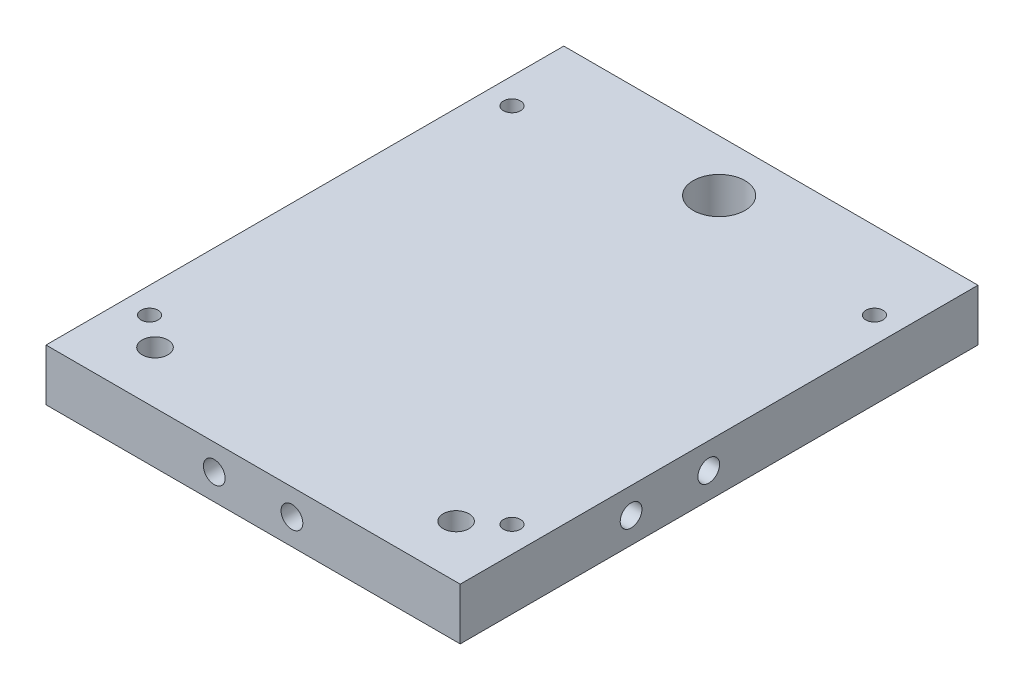
from build123d import *

# Parameters (mm, degrees)
SKETCH_1_W             = 80
SKETCH_1_H             = 100
EXTRUDE_1_DEPTH        = 10
HOLE_WIZARD_1_D        = 10
HOLE_WIZARD_M4_1_D     = 3.3
HOLE_WIZARD_M6_1_D     = 5
HOLE_WIZARD_M5_1_D     = 4.2
HOLE_WIZARD_M5_1_DEPTH = 12.4
HOLE_WIZARD_M5_1_TIP   = 1.2618073
HOLE_WIZARD_M5_2_D     = 4.2
HOLE_WIZARD_M5_2_DEPTH = 12.4
HOLE_WIZARD_M5_2_TIP   = 1.2618073
HOLE_WIZARD_M5_3_D     = 4.2
HOLE_WIZARD_M5_3_DEPTH = 10.4
HOLE_WIZARD_M5_3_TIP   = 1.2618073


with BuildPart() as part:
    # 草图1 → 凸台-拉伸1 (new body)
    with BuildSketch(Plane(origin=(0, 0, 0), x_dir=(1, 0, 0), z_dir=(0, 1, 0))):
        Rectangle(SKETCH_1_W, SKETCH_1_H)
    extrude(amount=EXTRUDE_1_DEPTH)

    # 孔1 (through all)
    with Locations(Plane(origin=(0, 10, 0), x_dir=(1, 0, 0), z_dir=(0, 1, 0))):
        with Locations((0, 40)):
            Hole(HOLE_WIZARD_1_D / 2)

    # M4 螺纹孔1 (through all)
    with Locations(Plane(origin=(0, 0, 0), x_dir=(-1, 0, 0), z_dir=(0, -1, 0))):
        with Locations((35, -35), (-35, -35), (-35, 35), (35, 35)):
            Hole(HOLE_WIZARD_M4_1_D / 2)

    # M6 螺纹孔1 (through all)
    with Locations(Plane(origin=(0, 10, 0), x_dir=(1, 0, 0), z_dir=(0, 1, 0))):
        with Locations((-29.071712183, -39.873872767), (29.071712183, -39.873872767)):
            Hole(HOLE_WIZARD_M6_1_D / 2)

    # M5 螺纹孔1
    with Locations(Plane(origin=(40, 0, 0), x_dir=(0, 0, -1), z_dir=(1, 0, 0))):
        with Locations((-17, 5), (-2, 5)):
            Hole(HOLE_WIZARD_M5_1_D / 2, depth=HOLE_WIZARD_M5_1_DEPTH)
            with Locations((0, 0, -(HOLE_WIZARD_M5_1_DEPTH + HOLE_WIZARD_M5_1_TIP / 2))):  # 118° drill point
                Cone(0, HOLE_WIZARD_M5_1_D / 2, HOLE_WIZARD_M5_1_TIP, mode=Mode.SUBTRACT)

    # M5 螺纹孔2
    with Locations(Plane.ZY.offset(40)):
        with Locations((5, 5), (-8, 5)):
            Hole(HOLE_WIZARD_M5_2_D / 2, depth=HOLE_WIZARD_M5_2_DEPTH)
            with Locations((0, 0, -(HOLE_WIZARD_M5_2_DEPTH + HOLE_WIZARD_M5_2_TIP / 2))):  # 118° drill point
                Cone(0, HOLE_WIZARD_M5_2_D / 2, HOLE_WIZARD_M5_2_TIP, mode=Mode.SUBTRACT)

    # M5 螺纹孔3
    with Locations(Plane.XY.offset(50)):
        with Locations((-7.5, 5), (7.5, 5)):
            Hole(HOLE_WIZARD_M5_3_D / 2, depth=HOLE_WIZARD_M5_3_DEPTH)
            with Locations((0, 0, -(HOLE_WIZARD_M5_3_DEPTH + HOLE_WIZARD_M5_3_TIP / 2))):  # 118° drill point
                Cone(0, HOLE_WIZARD_M5_3_D / 2, HOLE_WIZARD_M5_3_TIP, mode=Mode.SUBTRACT)


solid = part.part
